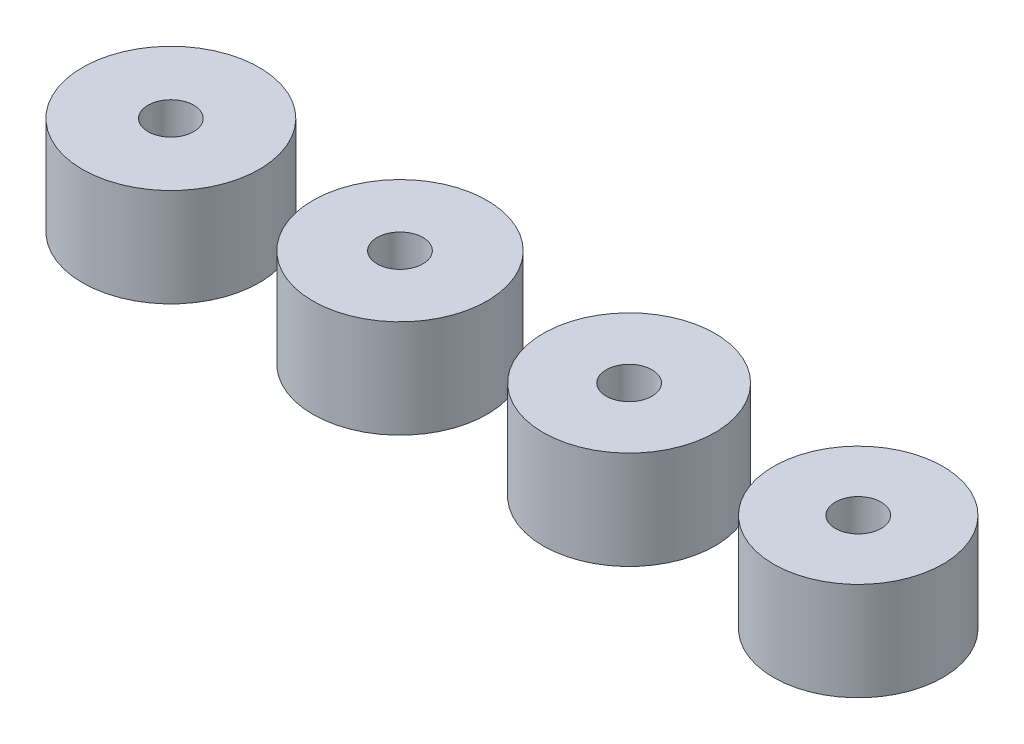
from build123d import *

# Parameters (mm, degrees)
SZKIC1_R                      = 5.4
SZKIC1_R_2                    = 1.4
DODANIE_WYCI_GNI_CIE1_DEPTH   = 6
SZKIC1_R_3                    = 5.325
DODANIE_WYCI_GNI_CIE1_2_DEPTH = 6
SZKIC1_R_4                    = 5.25
DODANIE_WYCI_GNI_CIE1_3_DEPTH = 6
SZKIC1_R_5                    = 5.175
DODANIE_WYCI_GNI_CIE1_4_DEPTH = 6


with BuildPart() as part:
    # Szkic1 → Dodanie-wyciągnięcie1 (new body)
    with BuildSketch(Plane(origin=(0, 6, 0), x_dir=(1, 0, 0), z_dir=(0, 1, 0))):
        with Locations(Location((0, -302.800228056, 0), (0, 0, 270))):
            Circle(SZKIC1_R)
        with Locations(Location((0, -302.800228056, 0), (0, 0, 270))):
            Circle(SZKIC1_R_2, mode=Mode.SUBTRACT)
    extrude(amount=DODANIE_WYCI_GNI_CIE1_DEPTH)


with BuildPart() as body_2:
    # Szkic1 → Dodanie-wyci_gni_cie1 2 (new body)
    with BuildSketch(Plane(origin=(0, 6, 0), x_dir=(1, 0, 0), z_dir=(0, 1, 0))):
        with Locations(Location((14, -302.800228056, 0), (0, 0, 270))):
            Circle(SZKIC1_R_3)
        with Locations(Location((14, -302.800228056, 0), (0, 0, 270))):
            Circle(SZKIC1_R_2, mode=Mode.SUBTRACT)
    extrude(amount=DODANIE_WYCI_GNI_CIE1_2_DEPTH)


with BuildPart() as body_3:
    # Szkic1 → Dodanie-wyci_gni_cie1 3 (new body)
    with BuildSketch(Plane(origin=(0, 6, 0), x_dir=(1, 0, 0), z_dir=(0, 1, 0))):
        with Locations(Location((28, -302.800228056, 0), (0, 0, 270))):
            Circle(SZKIC1_R_4)
        with Locations(Location((28, -302.800228056, 0), (0, 0, 270))):
            Circle(SZKIC1_R_2, mode=Mode.SUBTRACT)
    extrude(amount=DODANIE_WYCI_GNI_CIE1_3_DEPTH)


with BuildPart() as body_4:
    # Szkic1 → Dodanie-wyci_gni_cie1 4 (new body)
    with BuildSketch(Plane(origin=(0, 6, 0), x_dir=(1, 0, 0), z_dir=(0, 1, 0))):
        with Locations(Location((42, -302.800228056, 0), (0, 0, 270))):
            Circle(SZKIC1_R_5)
        with Locations(Location((42, -302.800228056, 0), (0, 0, 270))):
            Circle(SZKIC1_R_2, mode=Mode.SUBTRACT)
    extrude(amount=DODANIE_WYCI_GNI_CIE1_4_DEPTH)


solid = Compound([part.part, body_2.part, body_3.part, body_4.part])
